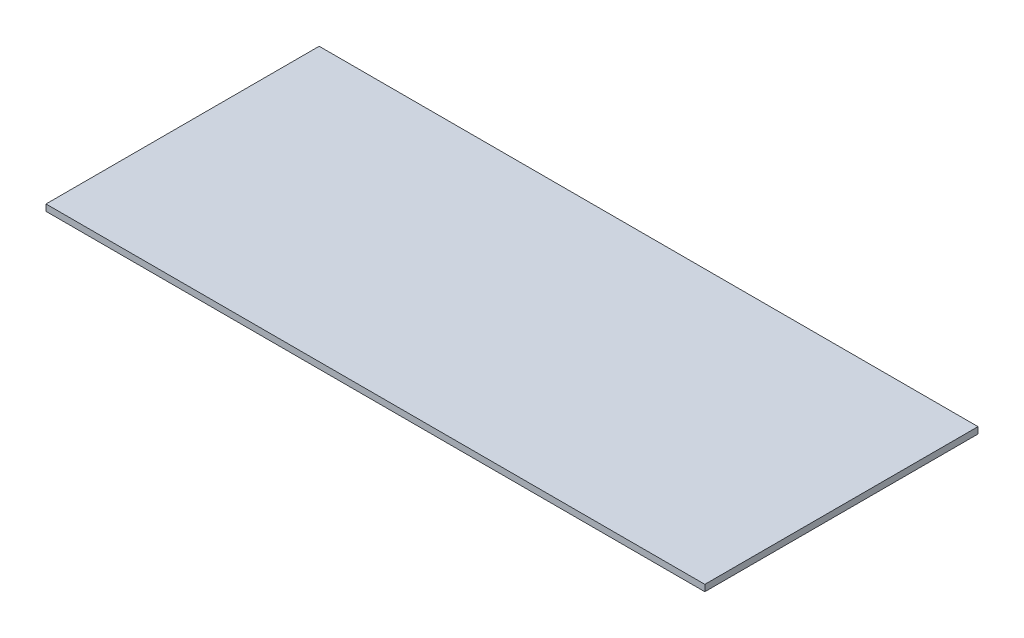
from build123d import *

# Parameters (mm, degrees)
SKETCH1_W           = 410
SKETCH1_H           = 170
BOSS_EXTRUDE1_DEPTH = 4


with BuildPart() as part:
    # Sketch1 → Boss-Extrude1 (new body)
    with BuildSketch(Plane(origin=(0, 0, 0), x_dir=(1, 0, 0), z_dir=(0, 1, 0))):
        Rectangle(SKETCH1_W, SKETCH1_H)
    extrude(amount=BOSS_EXTRUDE1_DEPTH)


solid = part.part
